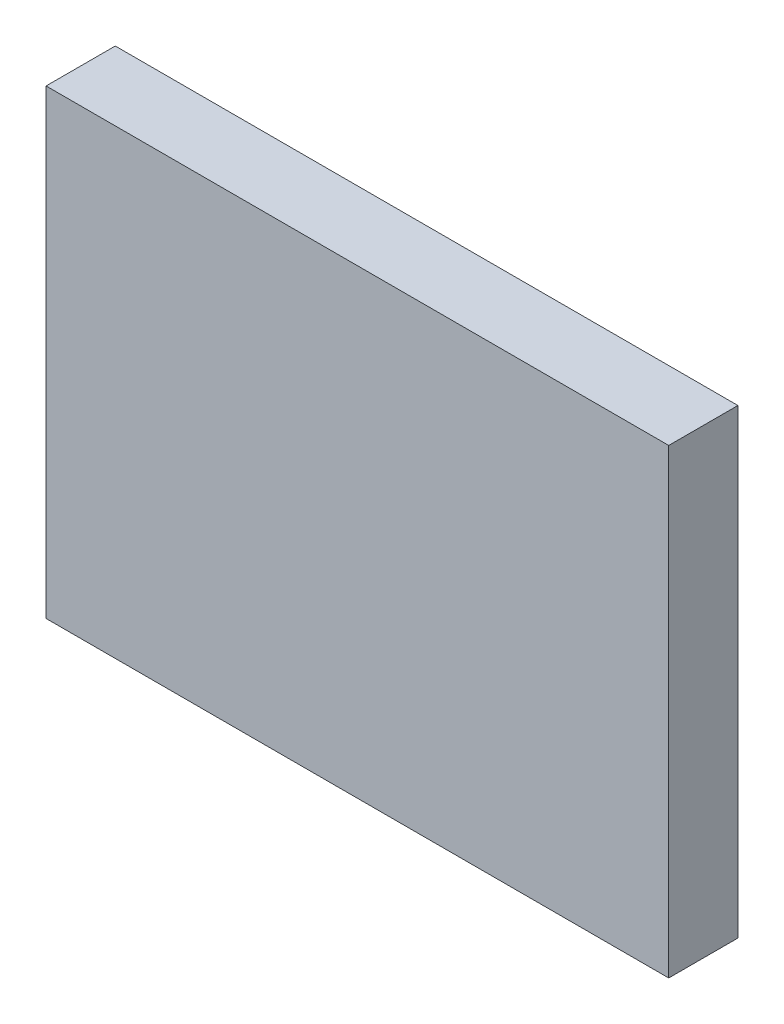
from build123d import *

# Parameters (mm, degrees)
SKETCH1_W           = 171.45
SKETCH1_H           = 127
BOSS_EXTRUDE1_DEPTH = 9.525


with BuildPart() as part:
    # Sketch1 → Boss-Extrude1 (new, symmetric)
    with BuildSketch(Plane.XY):
        Rectangle(SKETCH1_W, SKETCH1_H)
    extrude(amount=BOSS_EXTRUDE1_DEPTH, both=True)


solid = part.part
